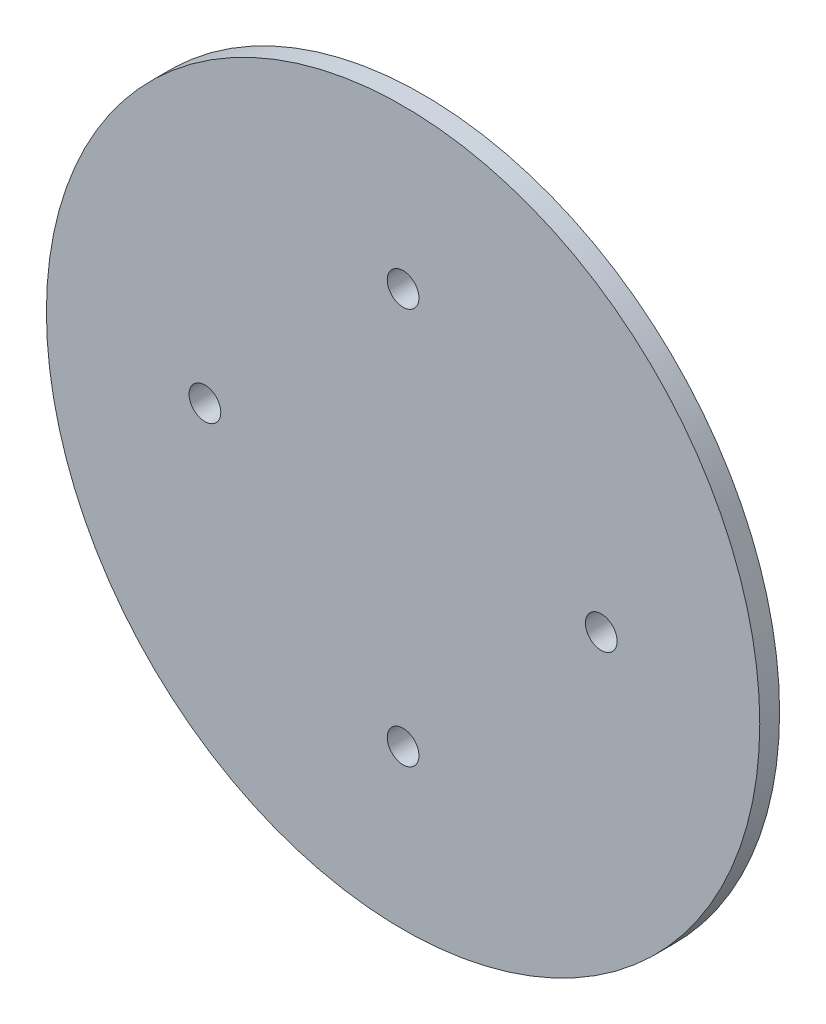
from build123d import *

# Parameters (mm, degrees)
SKETCH_1_R          = 23.5
EXTRUDE_1_DEPTH     = 4
SKETCH_2_R          = 22.225
EXTRUDE_2_DEPTH     = 3.175
SKETCH_3_R          = 1.6
CUT_EXTRUDE_1_DEPTH = 34.999715072
SKETCH_4_R          = 36
SKETCH_4_R_2        = 1.6
EXTRUDE_3_DEPTH     = 2


with BuildPart() as part:
    # ｽｹｯﾁ1 → ﾎﾞｽ - 押し出し1 (new body)
    with BuildSketch(Plane.XY):
        Circle(SKETCH_1_R)
    extrude(amount=EXTRUDE_1_DEPTH)

    # ｽｹｯﾁ2 → ﾎﾞｽ - 押し出し2 (add)
    with BuildSketch(Plane(origin=(0, 0, 0), x_dir=(-1, 0, 0), z_dir=(0, 0, -1))):
        Circle(SKETCH_2_R)
    extrude(amount=EXTRUDE_2_DEPTH)

    # ｽｹｯﾁ3 → ｶｯﾄ - 押し出し1 (cut, through all)
    with BuildSketch(Plane(origin=(0, 0, -3.175), x_dir=(-1, 0, 0), z_dir=(0, 0, -1))):
        with Locations((0, 20)):
            Circle(SKETCH_3_R)
        with Locations((20, 0)):
            Circle(SKETCH_3_R)
        with Locations((0, -20)):
            Circle(SKETCH_3_R)
        with Locations((-20, 0)):
            Circle(SKETCH_3_R)
    extrude(amount=-CUT_EXTRUDE_1_DEPTH, mode=Mode.SUBTRACT)

    # ｽｹｯﾁ4 → ﾎﾞｽ - 押し出し3 (add)
    with BuildSketch(Plane.XY.offset(4)):
        Circle(SKETCH_4_R)
        with Locations(Location((0, 20, 0), (0, 0, 180))):
            Circle(SKETCH_4_R_2, mode=Mode.SUBTRACT)
        with Locations(Location((-20, 0, 0), (0, 0, 180))):
            Circle(SKETCH_4_R_2, mode=Mode.SUBTRACT)
        with Locations(Location((0, -20, 0), (0, 0, 180))):
            Circle(SKETCH_4_R_2, mode=Mode.SUBTRACT)
        with Locations(Location((20, 0, 0), (0, 0, 180))):
            Circle(SKETCH_4_R_2, mode=Mode.SUBTRACT)
    extrude(amount=EXTRUDE_3_DEPTH)


solid = part.part
